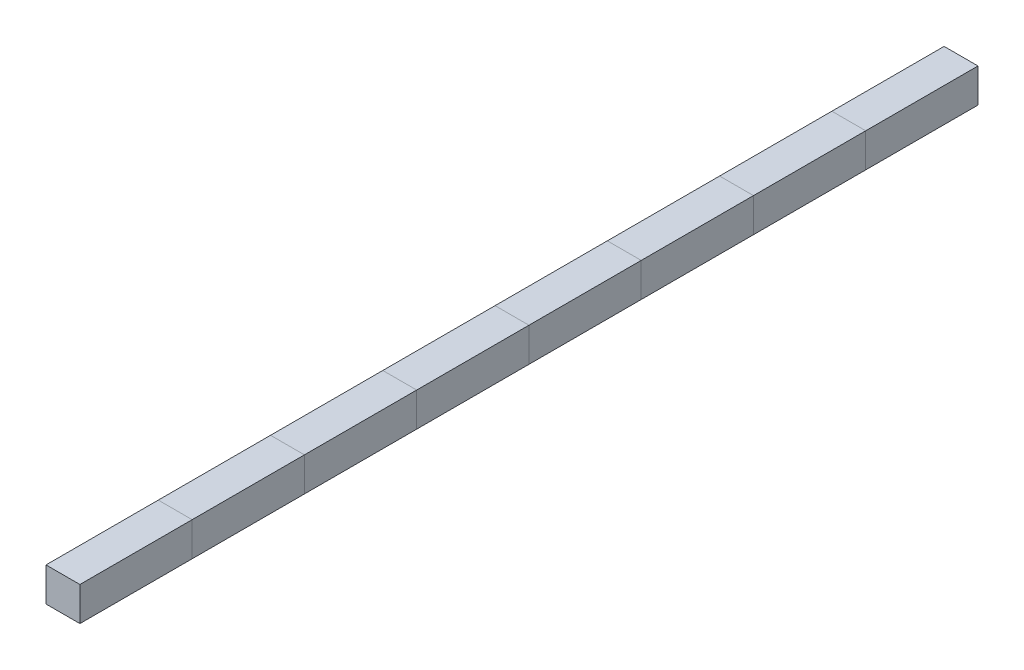
from build123d import *

# Parameters (mm, degrees)
SKETCH1_W           = 20
SKETCH1_H           = 20
BOSS_EXTRUDE1_DEPTH = 66.25
LPATTERN1_COUNT     = 8
LPATTERN1_PITCH     = 66.25


with BuildPart() as part:
    # Sketch1 → Boss-Extrude1 (new body)
    with BuildSketch(Plane.XY):
        Rectangle(SKETCH1_W, SKETCH1_H)
    extrude(amount=BOSS_EXTRUDE1_DEPTH)


with BuildPart() as lpattern1_1:
    # LPattern1: pattern copy
    add(part.part.moved(Location(Vector(0, 0, -1) * (1 * LPATTERN1_PITCH))))


with BuildPart() as lpattern1_2:
    # LPattern1: pattern copy
    add(part.part.moved(Location(Vector(0, 0, -1) * (2 * LPATTERN1_PITCH))))


with BuildPart() as lpattern1_3:
    # LPattern1: pattern copy
    add(part.part.moved(Location(Vector(0, 0, -1) * (3 * LPATTERN1_PITCH))))


with BuildPart() as lpattern1_4:
    # LPattern1: pattern copy
    add(part.part.moved(Location(Vector(0, 0, -1) * (4 * LPATTERN1_PITCH))))


with BuildPart() as lpattern1_5:
    # LPattern1: pattern copy
    add(part.part.moved(Location(Vector(0, 0, -1) * (5 * LPATTERN1_PITCH))))


with BuildPart() as lpattern1_6:
    # LPattern1: pattern copy
    add(part.part.moved(Location(Vector(0, 0, -1) * (6 * LPATTERN1_PITCH))))


with BuildPart() as lpattern1_7:
    # LPattern1: pattern copy
    add(part.part.moved(Location(Vector(0, 0, -1) * (7 * LPATTERN1_PITCH))))


solid = Compound([part.part, lpattern1_1.part, lpattern1_2.part, lpattern1_3.part, lpattern1_4.part, lpattern1_5.part, lpattern1_6.part, lpattern1_7.part])
